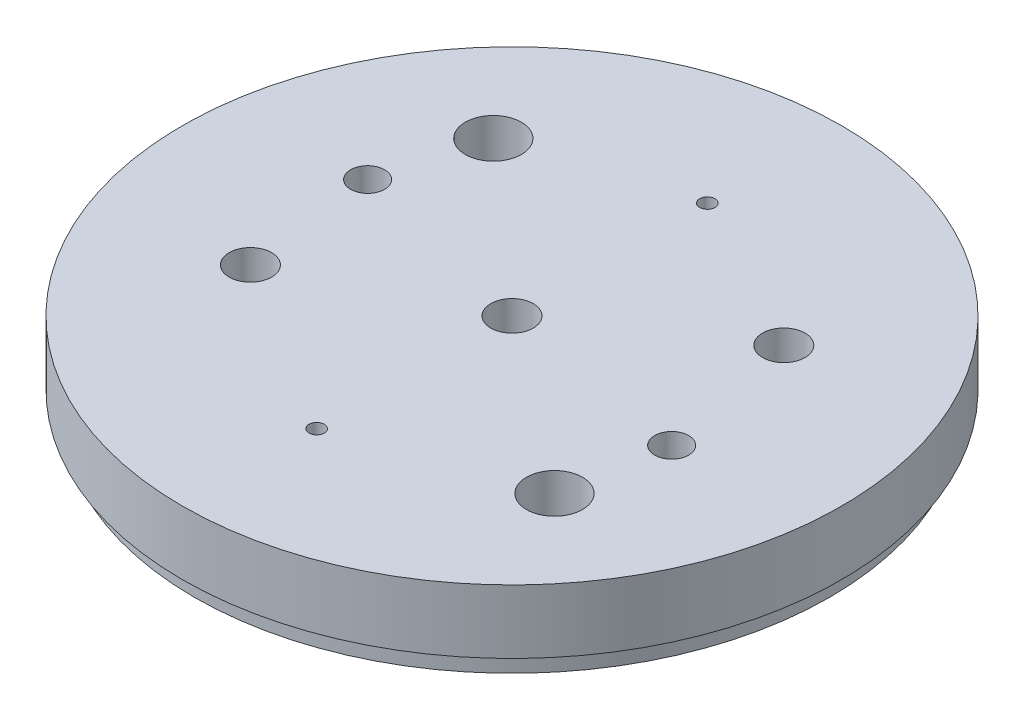
from build123d import *

# Parameters (mm, degrees)
SKETCH1_R           = 49.276
BOSS_EXTRUDE1_DEPTH = 9.525
SKETCH2_R           = 47.498
BOSS_EXTRUDE2_DEPTH = 3.175
SKETCH5_R           = 3.175
SKETCH5_R_2         = 1.143
SKETCH5_R_3         = 4.191
SKETCH5_R_4         = 2.54
CUT_EXTRUDE1_DEPTH  = 71.834584434


with BuildPart() as part:
    # Sketch1 → Boss-Extrude1 (new body)
    with BuildSketch(Plane(origin=(0, 0, 0), x_dir=(1, 0, 0), z_dir=(0, 1, 0))):
        with Locations(Location((0, 0, 0), (0, 0, 270))):
            Circle(SKETCH1_R)
    extrude(amount=-BOSS_EXTRUDE1_DEPTH)

    # Sketch2 → Boss-Extrude2 (add)
    with BuildSketch(Plane.XZ.offset(9.525)):
        with Locations(Location((0, 0, 0), (0, 0, 270))):
            Circle(SKETCH2_R)
    extrude(amount=BOSS_EXTRUDE2_DEPTH)

    # Sketch5 → Cut-Extrude1 (cut, through all)
    with BuildSketch(Plane(origin=(0, 0, 0), x_dir=(1, 0, 0), z_dir=(0, 1, 0))):
        with Locations(Location((0, 0, 0), (0, 0, 270))):
            Circle(SKETCH5_R)
        with Locations(Location((0, 29.21, 0), (0, 0, 270))):
            Circle(SKETCH5_R_2)
        with Locations(Location((0, -29.21, 0), (0, 0, 270))):
            Circle(SKETCH5_R_2)
        with Locations(Location((-24.384, 21.59, 0), (0, 0, 270))):
            Circle(SKETCH5_R_3)
        with Locations(Location((-28.448, 6.858, 0), (0, 0, 270))):
            Circle(SKETCH5_R_4)
        with Locations(Location((-26.162, -12.954, 0), (0, 0, 270))):
            Circle(SKETCH5_R)
        with Locations(Location((26.162, -19.812, 0), (0, 0, 270))):
            Circle(SKETCH5_R_3)
        with Locations(Location((28.702, -4.826, 0), (0, 0, 270))):
            Circle(SKETCH5_R_4)
        with Locations(Location((24.13, 16.51, 0), (0, 0, 270))):
            Circle(SKETCH5_R)
    extrude(amount=-CUT_EXTRUDE1_DEPTH, mode=Mode.SUBTRACT)


solid = part.part
